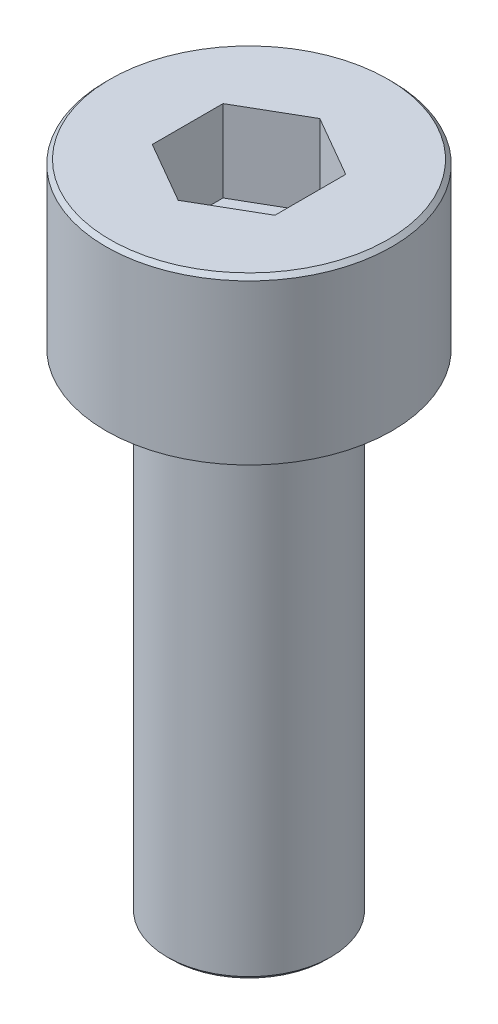
from build123d import *

# Parameters (mm, degrees)
SMUSSO1_SIZE             = 0.1
TAGLIO_ESTRUSIONE1_DEPTH = 2


with BuildPart() as part:
    # Schizzo1 → Rivoluzione1 (revolve)
    with BuildSketch(Plane.XY, mode=Mode.PRIVATE) as rivoluzione1_sk:
        Polygon((0, 0), (0, 4), (3.5, 4), (3.5, 0), (2, 0), (2, -12), (0, -12), align=None)
    revolve(rivoluzione1_sk.sketch.rotate(Axis((0, 28.388481997, 0), (0, -1, 0)), 90), axis=Axis((0, 28.388481997, 0), (0, -1, 0)))

    # Smusso1
    smusso1_edges = [part.edges().sort_by_distance(p)[0] for p in [
        (0, -12, -2),
        (0, 4, -3.5),
    ]]
    chamfer(smusso1_edges, length=SMUSSO1_SIZE)

    # Schizzo2 → Taglio-Estrusione1 (cut)
    with BuildSketch(Plane(origin=(0, 4, 0), x_dir=(1, 0, 0), z_dir=(0, 1, 0))):
        Polygon((0, 1.732050808), (-1.5, 0.866025404), (-1.5, -0.866025404), (0, -1.732050808), (1.5, -0.866025404), (1.5, 0.866025404), align=None)
    extrude(amount=-TAGLIO_ESTRUSIONE1_DEPTH, mode=Mode.SUBTRACT)


solid = part.part
